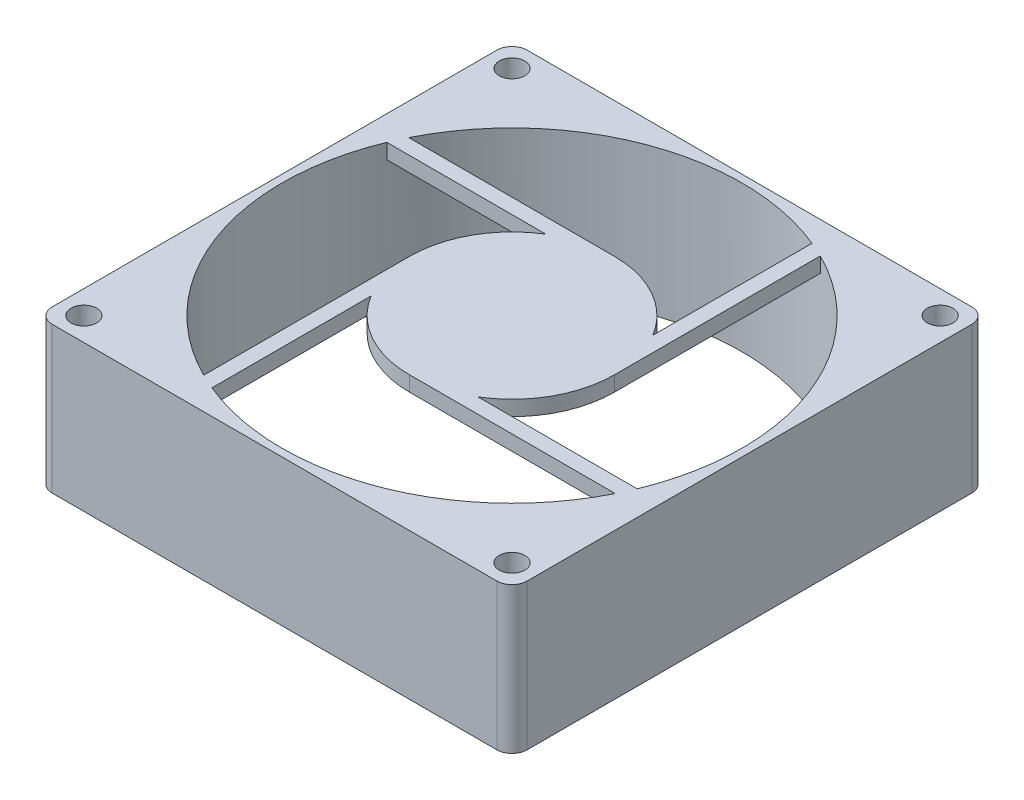
from build123d import *

# Parameters (mm, degrees)
SKETCH1_W           = 80.01
SKETCH1_H           = 80.01
BOSS_EXTRUDE1_DEPTH = 24.638
SKETCH2_R           = 38.735
SKETCH2_R_2         = 2.159
CUT_EXTRUDE1_DEPTH  = 24.638
FILLET1_R           = 2.54
BOSS_EXTRUDE2_DEPTH = 2.54


with BuildPart() as part:
    # Sketch1 → Boss-Extrude1 (new body)
    with BuildSketch(Plane(origin=(0, 0, 0), x_dir=(1, 0, 0), z_dir=(0, 1, 0))):
        Rectangle(SKETCH1_W, SKETCH1_H)
    extrude(amount=BOSS_EXTRUDE1_DEPTH)

    # Sketch2 → Cut-Extrude1 (cut)
    with BuildSketch(Plane(origin=(0, 24.638, 0), x_dir=(1, 0, 0), z_dir=(0, 1, 0))):
        with Locations(Location((0, 0, 0), (0, 0, 270))):
            Circle(SKETCH2_R)
        with Locations(Location((-36.068, 36.068, 0), (0, 0, 270))):
            Circle(SKETCH2_R_2)
        with Locations(Location((36.068, 36.068, 0), (0, 0, 270))):
            Circle(SKETCH2_R_2)
        with Locations(Location((36.068, -36.068, 0), (0, 0, 270))):
            Circle(SKETCH2_R_2)
        with Locations(Location((-36.068, -36.068, 0), (0, 0, 270))):
            Circle(SKETCH2_R_2)
    extrude(amount=-CUT_EXTRUDE1_DEPTH, mode=Mode.SUBTRACT)

    # Fillet1
    fillet1_edges = [part.edges().sort_by_distance(p)[0] for p in [
        (40.005, 12.319, 40.005),
        (-40.005, 12.319, 40.005),
        (-40.005, 12.319, -40.005),
        (40.005, 12.319, -40.005),
    ]]
    fillet(fillet1_edges, radius=FILLET1_R)

    # Sketch3 → Boss-Extrude2 (add)
    with BuildSketch(Plane(origin=(0, 24.638, 0), x_dir=(1, 0, 0), z_dir=(0, 1, 0))):
        with BuildLine():
            Line((17.272, 0), (17.272, 34.671))
            ThreePointArc((17.272, 34.671), (16.01238371, 35.270437946), (14.732, 35.824131546))
            Line((14.732, 35.824131546), (14.732, 9.016105589))
            ThreePointArc((14.732, 9.016105589), (8.443808627, 15.067318271), (0, 17.272))
            Line((0, 17.272), (-34.671, 17.272))
            ThreePointArc((-34.671, 17.272), (-35.270437946, 16.01238371), (-35.824131546, 14.732))
            Line((-35.824131546, 14.732), (-9.016105589, 14.732))
            ThreePointArc((-9.016105589, 14.732), (-15.067318271, 8.443808627), (-17.272, 0))
            Line((-17.272, 0), (-17.272, -34.671))
            ThreePointArc((-17.272, -34.671), (-16.01238371, -35.270437946), (-14.732, -35.824131546))
            Line((-14.732, -35.824131546), (-14.732, -9.016105589))
            ThreePointArc((-14.732, -9.016105589), (-8.443808627, -15.067318271), (0, -17.272))
            Line((0, -17.272), (34.671, -17.272))
            ThreePointArc((34.671, -17.272), (35.270437946, -16.01238371), (35.824131546, -14.732))
            Line((35.824131546, -14.732), (9.016105589, -14.732))
            ThreePointArc((9.016105589, -14.732), (15.067318271, -8.443808627), (17.272, 0))
        make_face()
    extrude(amount=-BOSS_EXTRUDE2_DEPTH)


solid = part.part
